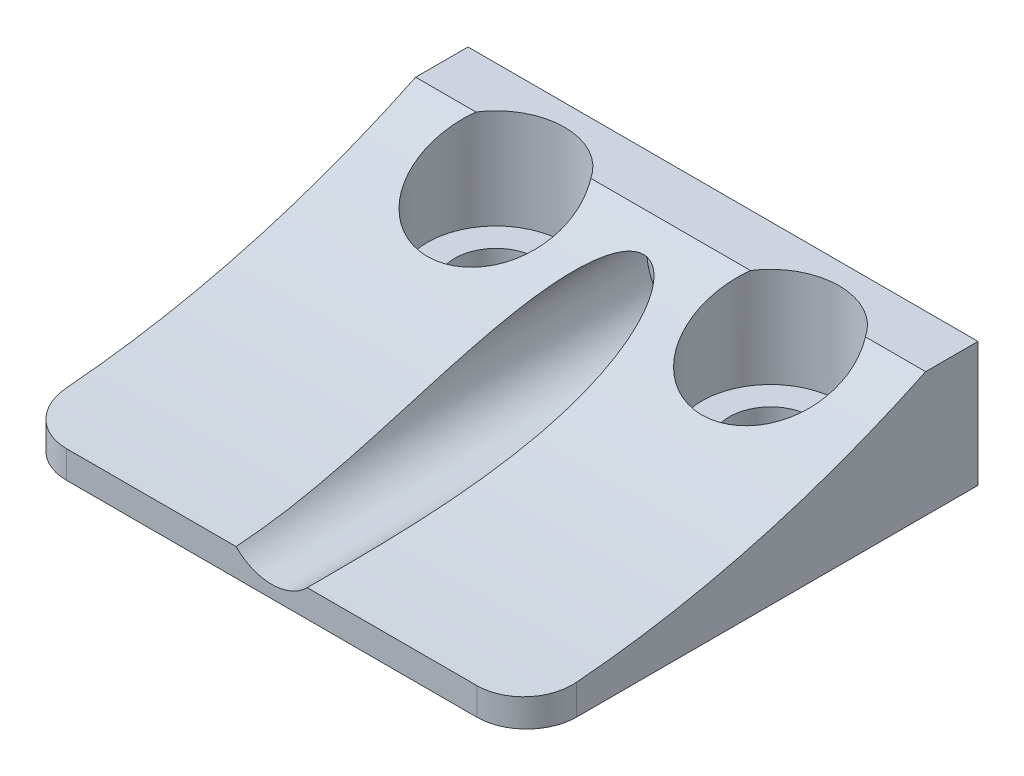
from build123d import *

# Parameters (mm, degrees)
SKETCH1_W                       = 20.45
SKETCH1_H                       = 18.1
BOSS_EXTRUDE2_DEPTH             = 1
BOSS_EXTRUDE3_REACH             = 15.691
BOSS_EXTRUDE3_DIRECTION_2_REACH = 15.691
SKETCH4_R                       = 1.65
CUT_EXTRUDE1_DEPTH              = 5
BOSS_EXTRUDE5_START             = -10.225
BOSS_EXTRUDE5_DEPTH             = 20.45
SKETCH6_R                       = 2.75
CUT_EXTRUDE2_DEPTH              = 4
SKETCH7_R                       = 1.15
CUT_EXTRUDE3_DEPTH              = 9.05
SKETCH8_R                       = 2
CUT_EXTRUDE4_DEPTH              = 8
CUT_EXTRUDE4_DIRECTION_2_REACH  = 16.541
FILLET1_R                       = 2


with BuildPart() as part:
    # Sketch1 → Boss-Extrude2 (new body)
    with BuildSketch(Plane(origin=(0, 0, 0), x_dir=(1, 0, 0), z_dir=(0, 1, 0))):
        Rectangle(SKETCH1_W, SKETCH1_H)
    extrude(amount=BOSS_EXTRUDE2_DEPTH)

    # Boss-Extrude3: up to this face of the body (flat: up to its plane)
    boss_extrude3_end = Plane(part.part.faces().sort_by_distance((10.225, 0.5, 0))[0])
    # Sketch3 → Boss-Extrude3 (add, up to the picked face)
    with BuildSketch(Plane(origin=(0, 0, 0), x_dir=(0, 0, -1), z_dir=(1, 0, 0)), mode=Mode.PRIVATE) as boss_extrude3_sk1:
        Polygon((9.05, 1), (9.05, 5), (7.05, 5), (3.05, 1), align=None)
    boss_extrude3_tool1 = split(extrude(boss_extrude3_sk1.sketch, amount=BOSS_EXTRUDE3_REACH, mode=Mode.PRIVATE), bisect_by=boss_extrude3_end, keep=Keep.BOTH, mode=Mode.PRIVATE)
    add(boss_extrude3_tool1.solids().sort_by(Axis((0, 2.666667, -6.883333), (1, 0, 0)))[0])

    # Boss-Extrude3 direction 2: up to this face of the body (flat: up to its plane)
    boss_extrude3_direction_2_end = Plane(part.part.faces().sort_by_distance((-10.225, 0.5, 0))[0])
    # Sketch3 → Boss-Extrude3 direction 2 (add, up to the picked face)
    with BuildSketch(Plane(origin=(0, 0, 0), x_dir=(0, 0, -1), z_dir=(1, 0, 0)), mode=Mode.PRIVATE) as boss_extrude3_direction_2_sk1:
        Polygon((9.05, 1), (9.05, 5), (7.05, 5), (3.05, 1), align=None)
    boss_extrude3_direction_2_tool1 = split(extrude(boss_extrude3_direction_2_sk1.sketch, amount=-BOSS_EXTRUDE3_DIRECTION_2_REACH, mode=Mode.PRIVATE), bisect_by=boss_extrude3_direction_2_end, keep=Keep.BOTH, mode=Mode.PRIVATE)
    add(boss_extrude3_direction_2_tool1.solids().sort_by(Axis((0, 2.666667, -6.883333), (-1, 0, 0)))[0])

    # Sketch4 → Cut-Extrude1 (cut)
    with BuildSketch(Plane(origin=(0, 5, 0), x_dir=(1, 0, 0), z_dir=(0, 1, 0))):
        with Locations(Location((-5.505, 5.45, 0), (0, 0, 104.141110234))):
            Circle(SKETCH4_R)
        with Locations(Location((5.505, 5.45, 0), (0, 0, 75.858889766))):
            Circle(SKETCH4_R)
    extrude(amount=-CUT_EXTRUDE1_DEPTH, mode=Mode.SUBTRACT)

    # Sketch10 → Boss-Extrude5 (add)
    with BuildSketch(Plane(origin=(0, 0, 0), x_dir=(0, 0, -1), z_dir=(1, 0, 0)).offset(BOSS_EXTRUDE5_START)):
        with BuildLine():
            Line((3.05, 1), (7.05, 5))
            Line((7.05, 5), (6.95, 5))
            ThreePointArc((6.95, 5), (-0.847118083, 2.217663929), (-9.05, 1.1))
            Line((-9.05, 1.1), (-9.05, 1))
            Line((-9.05, 1), (3.05, 1))
        make_face()
    extrude(amount=BOSS_EXTRUDE5_DEPTH)

    # Sketch6 → Cut-Extrude2 (cut)
    with BuildSketch(Plane(origin=(0, 5, 0), x_dir=(1, 0, 0), z_dir=(0, 1, 0))):
        with Locations(Location((-5.505, 5.45, 0), (0, 0, 270))):
            Circle(SKETCH6_R)
        with Locations(Location((5.505, 5.45, 0), (0, 0, 270))):
            Circle(SKETCH6_R)
    extrude(amount=-CUT_EXTRUDE2_DEPTH, mode=Mode.SUBTRACT)

    # Sketch7 → Cut-Extrude3 (cut)
    with BuildSketch(Plane.XY):
        with Locations((0, 2.5)):
            Circle(SKETCH7_R)
    extrude(amount=-CUT_EXTRUDE3_DEPTH, mode=Mode.SUBTRACT)

    # Sketch8 → Cut-Extrude4 (cut)
    with BuildSketch(Plane.XY):
        with Locations(Location((0, 2.5, 0), (0, 0, 224.427004001))):
            Circle(SKETCH8_R)
    extrude(amount=-CUT_EXTRUDE4_DEPTH, mode=Mode.SUBTRACT)

    # Cut-Extrude4 direction 2: up to this face of the body (flat: up to its plane)
    cut_extrude4_direction_2_end = Plane(part.part.faces().sort_by_distance((0, 0.55, 9.05))[0])
    # Sketch8 → Cut-Extrude4 direction 2 (cut, up to the picked face)
    with BuildSketch(Plane.XY, mode=Mode.PRIVATE) as cut_extrude4_direction_2_sk1:
        with Locations(Location((0, 2.5, 0), (0, 0, 224.427004001))):
            Circle(SKETCH8_R)
    cut_extrude4_direction_2_tool1 = split(extrude(cut_extrude4_direction_2_sk1.sketch, amount=CUT_EXTRUDE4_DIRECTION_2_REACH, mode=Mode.PRIVATE), bisect_by=cut_extrude4_direction_2_end, keep=Keep.BOTH, mode=Mode.PRIVATE)
    add(cut_extrude4_direction_2_tool1.solids().sort_by(Axis((0, 2.5, 0), (0, 0, 1)))[0], mode=Mode.SUBTRACT)

    # Fillet1
    fillet1_edges = [part.edges().sort_by_distance(p)[0] for p in [
        (10.225, 0.55, 9.05),
        (-10.225, 0.55, 9.05),
    ]]
    fillet(fillet1_edges, radius=FILLET1_R)


solid = part.part
